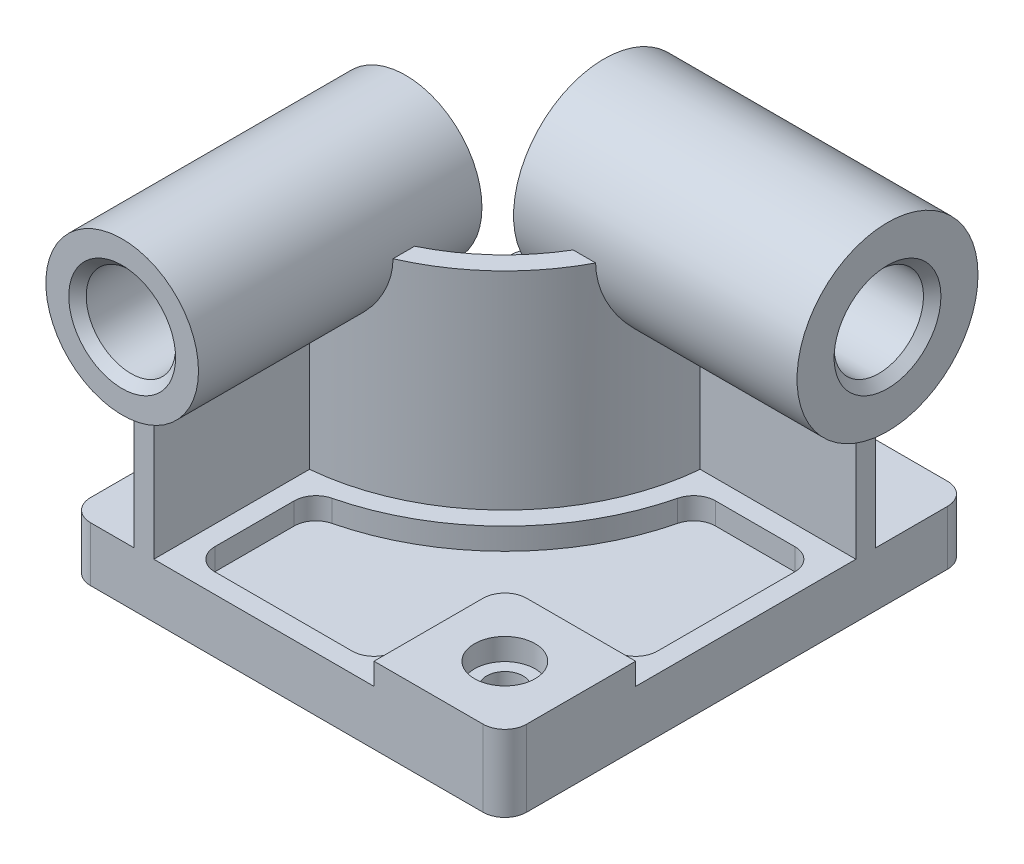
from build123d import *

# Parameters (mm, degrees)
SKETCH1_W                = 200
SKETCH1_H                = 213
BOSS_EXTRUDE1_DEPTH      = 25
FILLET1_R                = 10
BOSS_EXTRUDE2_START      = 10
BOSS_EXTRUDE2_DEPTH      = 10
BOSS_EXTRUDE3_DEPTH      = 95
BOSS_EXTRUDE4_DEPTH      = 10
BOSS_EXTRUDE4_DEPTH_BACK = 120
SKETCH4_R                = 35
CUT_EXTRUDE1_DEPTH       = 290.575983208
CUT_EXTRUDE1_DEPTH_BACK  = 290.575983208
SKETCH6_R                = 20.5
BOSS_EXTRUDE5_DEPTH      = 10
BOSS_EXTRUDE5_DEPTH_BACK = 120
SKETCH7_R                = 41.5
CUT_EXTRUDE2_DEPTH       = 290.766716644
CUT_EXTRUDE2_DEPTH_BACK  = 290.766716644
SKETCH8_R                = 20.5
CHAMFER1_SIZE            = 4
CUT_EXTRUDE3_DEPTH       = 10
SKETCH10_R               = 13.920178612
CUT_EXTRUDE4_DEPTH       = 10
SKETCH11_R               = 8.357374053
CUT_EXTRUDE5_DEPTH       = 211.486341717


with BuildPart() as part:
    # Sketch1 → Boss-Extrude1 (new body)
    with BuildSketch(Plane(origin=(0, 0, 0), x_dir=(1, 0, 0), z_dir=(0, 1, 0))):
        Rectangle(SKETCH1_W, SKETCH1_H)
    extrude(amount=BOSS_EXTRUDE1_DEPTH)

    # Fillet1
    fillet1_edges = [part.edges().sort_by_distance(p)[0] for p in [
        (100, 12.5, 106.5),
        (-100, 12.5, 106.5),
        (-100, 12.5, -106.5),
        (100, 12.5, -106.5),
    ]]
    fillet(fillet1_edges, radius=FILLET1_R)

    # Sketch2 → Boss-Extrude2 (add)
    with BuildSketch(Plane(origin=(0, 25, 0), x_dir=(1, 0, 0), z_dir=(0, 1, 0)).offset(BOSS_EXTRUDE2_START)):
        with BuildLine():
            Line((50, -46.5), (100, -46.5))
            Line((100, -46.5), (100, -96.5))
            ThreePointArc((100, -96.5), (97.071067812, -103.571067812), (90, -106.5))
            Line((90, -106.5), (40, -106.5))
            Line((40, -106.5), (40, -56.5))
            ThreePointArc((40, -56.5), (42.928932188, -49.428932188), (50, -46.5))
        make_face()
    extrude(amount=-BOSS_EXTRUDE2_DEPTH)

    # Sketch3 → Boss-Extrude3 (add)
    with BuildSketch(Plane(origin=(0, 25, 0), x_dir=(1, 0, 0), z_dir=(0, 1, 0))):
        with BuildLine():
            Line((100, 63.5), (20, 63.5))
            ThreePointArc((20, 63.5), (-6.360389693, -0.139610307), (-70, -26.5))
            Line((-70, -26.5), (-70, -106.5))
            Line((-70, -106.5), (-61, -106.5))
            Line((-61, -106.5), (-61, -35.090060351))
            ThreePointArc((-61, -35.090060351), (0.003571337, -6.503571337), (28.590060351, 54.5))
            Line((28.590060351, 54.5), (100, 54.5))
            Line((100, 54.5), (100, 63.5))
        make_face()
    extrude(amount=BOSS_EXTRUDE3_DEPTH)

    # Sketch4 → Boss-Extrude4 (add, two sides: drawn at the far end of the back side and taken through both)
    with BuildSketch(Plane.XY.offset(106.5).offset(-BOSS_EXTRUDE4_DEPTH_BACK)):
        with Locations((-65.5, 120)):
            Circle(SKETCH4_R)
    extrude(amount=BOSS_EXTRUDE4_DEPTH + BOSS_EXTRUDE4_DEPTH_BACK)

    # Sketch6 → Cut-Extrude1 (cut, two sides: drawn at the far end of the back side and taken through both)
    with BuildSketch(Plane.XY.offset(116.5).offset(-CUT_EXTRUDE1_DEPTH_BACK)):
        with Locations((-65.5, 120)):
            Circle(SKETCH6_R)
    extrude(amount=CUT_EXTRUDE1_DEPTH + CUT_EXTRUDE1_DEPTH_BACK, mode=Mode.SUBTRACT)

    # Sketch7 → Boss-Extrude5 (add, two sides: drawn at the far end of the back side and taken through both)
    with BuildSketch(Plane(origin=(100, 0, 0), x_dir=(0, 0, -1), z_dir=(1, 0, 0)).offset(-BOSS_EXTRUDE5_DEPTH_BACK)):
        with Locations((59, 120)):
            Circle(SKETCH7_R)
    extrude(amount=BOSS_EXTRUDE5_DEPTH + BOSS_EXTRUDE5_DEPTH_BACK)

    # Sketch8 → Cut-Extrude2 (cut, two sides: drawn at the far end of the back side and taken through both)
    with BuildSketch(Plane(origin=(110, 0, 0), x_dir=(0, 0, -1), z_dir=(1, 0, 0)).offset(-CUT_EXTRUDE2_DEPTH_BACK)):
        with Locations((59, 120)):
            Circle(SKETCH8_R)
    extrude(amount=CUT_EXTRUDE2_DEPTH + CUT_EXTRUDE2_DEPTH_BACK, mode=Mode.SUBTRACT)

    # Chamfer1
    chamfer1_edges = [part.edges().sort_by_distance(p)[0] for p in [
        (-20, 120, -38.5),
        (110, 120, -38.5),
        (-86, 120, -13.5),
        (-86, 120, 116.5),
    ]]
    chamfer(chamfer1_edges, length=CHAMFER1_SIZE)

    # Sketch9 → Cut-Extrude3 (cut)
    with BuildSketch(Plane(origin=(0, 25, 0), x_dir=(1, 0, 0), z_dir=(0, 1, 0))):
        with BuildLine():
            Line((81, 45.5), (44.629839047, 45.5))
            ThreePointArc((44.629839047, 45.5), (38.454436775, 43.365392983), (34.915445908, 37.872881356))
            ThreePointArc((34.915445908, 37.872881356), (6.367532368, -12.867532368), (-44.372881356, -41.415445908))
            ThreePointArc((-44.372881356, -41.415445908), (-49.865392983, -44.954436775), (-52, -51.129839047))
            Line((-52, -51.129839047), (-52, -87.5))
            ThreePointArc((-52, -87.5), (-49.071067812, -94.571067812), (-42, -97.5))
            Line((-42, -97.5), (21, -97.5))
            ThreePointArc((21, -97.5), (28.071067812, -94.571067812), (31, -87.5))
            Line((31, -87.5), (31, -56.5))
            ThreePointArc((31, -56.5), (36.564971157, -43.064971157), (50, -37.5))
            Line((50, -37.5), (81, -37.5))
            ThreePointArc((81, -37.5), (88.071067812, -34.571067812), (91, -27.5))
            Line((91, -27.5), (91, 35.5))
            ThreePointArc((91, 35.5), (88.071067812, 42.571067812), (81, 45.5))
        make_face()
    extrude(amount=-CUT_EXTRUDE3_DEPTH, mode=Mode.SUBTRACT)

    # Sketch10 → Cut-Extrude4 (cut)
    with BuildSketch(Plane(origin=(0, 35, 0), x_dir=(1, 0, 0), z_dir=(0, 1, 0))):
        with Locations(Location((70, -76.5, 0), (0, 0, 270))):
            Circle(SKETCH10_R)
    extrude(amount=-CUT_EXTRUDE4_DEPTH, mode=Mode.SUBTRACT)

    # Sketch11 → Cut-Extrude5 (cut, through all)
    with BuildSketch(Plane(origin=(0, 25, 0), x_dir=(1, 0, 0), z_dir=(0, 1, 0))):
        with Locations(Location((70, -76.5, 0), (0, 0, 270))):
            Circle(SKETCH11_R)
    extrude(amount=-CUT_EXTRUDE5_DEPTH, mode=Mode.SUBTRACT)


solid = part.part
